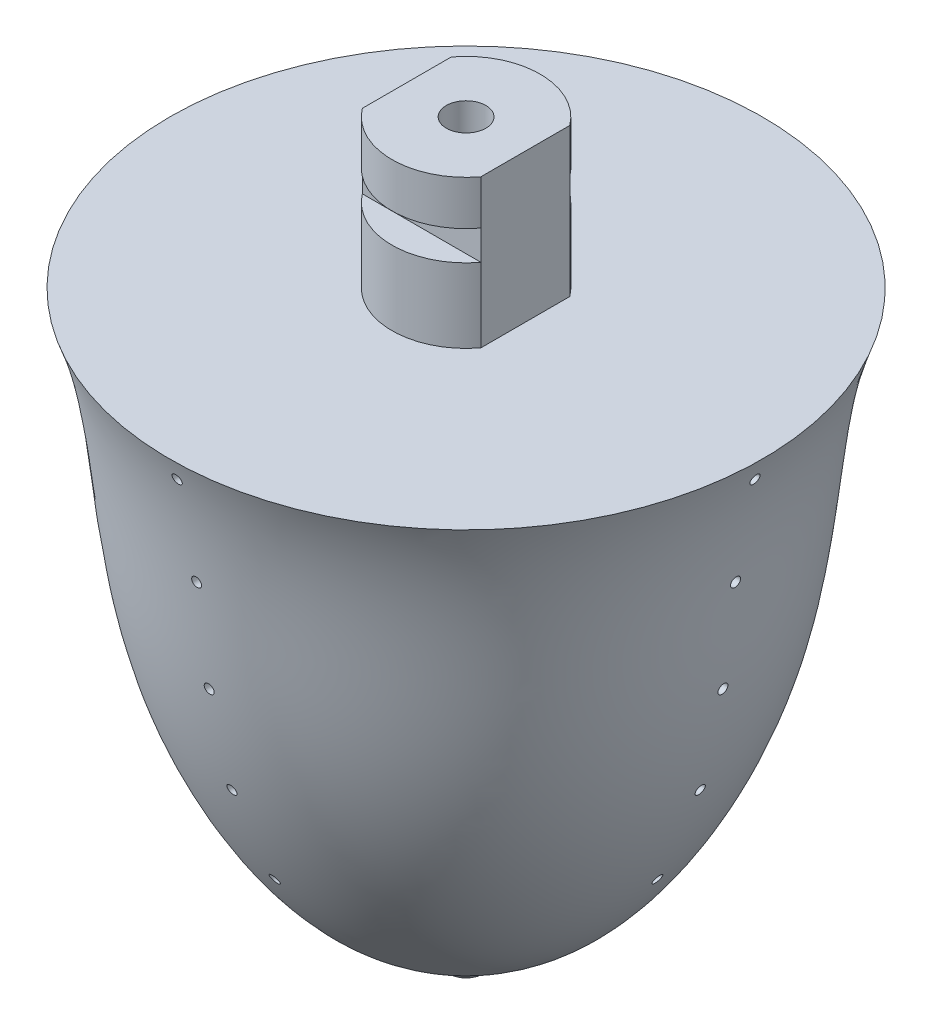
from build123d import *

# Parameters (mm, degrees)
BOSS_EXTRUDE1_DEPTH = 30
SKETCH3_R           = 4
CUT_EXTRUDE1_DEPTH  = 30
CUT_EXTRUDE2_REACH  = 152.867
SKETCH5_W           = 24
SKETCH5_H           = 6
CUT_EXTRUDE3_REACH  = 148.969
SKETCH6_R           = 1
CIRPATTERN1_COUNT   = 4


with BuildPart() as part:
    # Sketch1 → Revolve5 (revolve)
    with BuildSketch(Plane.XY, mode=Mode.PRIVATE) as revolve5_sk:
        with BuildLine():
            Line((0, 0), (60, 0))
            add(Edge.make_bspline(
                [(13.077250629, -110), (26.441462871, -105.381596251), (58.400000122, -57.571050955), (51.598678878, -21.794632863), (60, 0)],
                knots=[0.017667594, 0.017667594, 0.017667594, 0.017667594, 0.353401106, 1, 1, 1, 1], degree=3))
            ThreePointArc((13.077250629, -110), (8.624288133, -112.501880222), (5.3315658, -116.406526078))
            ThreePointArc((5.3315658, -116.406526078), (3.082984988, -118.82225748), (0, -120))
            Line((0, -120), (0, 0))
        make_face()
    revolve(revolve5_sk.sketch.rotate(Axis((0, 0, 0), (0, -1, 0)), 180), axis=Axis((0, 0, 0), (0, -1, 0)))

    # Sketch2 → Boss-Extrude1 (add)
    with BuildSketch(Plane(origin=(0, 0, 0), x_dir=(1, 0, 0), z_dir=(0, 1, 0))):
        with BuildLine():
            Line((12, 9), (12, -9))
            ThreePointArc((12, -9), (0, -15), (-12, -9))
            Line((-12, -9), (-12, 9))
            ThreePointArc((-12, 9), (0, 15), (12, 9))
        make_face()
    extrude(amount=BOSS_EXTRUDE1_DEPTH)

    # Sketch3 → Cut-Extrude1 (cut)
    with BuildSketch(Plane(origin=(0, 30, 0), x_dir=(1, 0, 0), z_dir=(0, 1, 0))):
        with Locations(Location((0, 0, 0), (0, 0, 270))):
            Circle(SKETCH3_R)
    extrude(amount=-CUT_EXTRUDE1_DEPTH, mode=Mode.SUBTRACT)

    # Sketch5 → Cut-Extrude2 (cut, up to next)
    with BuildSketch(Plane.XY.offset(9), mode=Mode.PRIVATE) as cut_extrude2_sk1:
        with Locations((0, 18)):
            Rectangle(SKETCH5_W, SKETCH5_H)
    cut_extrude2_tool1 = extrude(cut_extrude2_sk1.sketch, amount=CUT_EXTRUDE2_REACH, mode=Mode.PRIVATE) & part.part
    cut_extrude2 = cut_extrude2_tool1.solids().sort_by_distance((0, 18, 9))[0]
    add(cut_extrude2, mode=Mode.SUBTRACT)

    # Mirror1: Cut-Extrude2 across plane
    add(cut_extrude2.mirror(Plane.XY), mode=Mode.SUBTRACT)

    # Sketch6 → Cut-Extrude3 (cut, up to next)
    with BuildSketch(Plane(origin=(0, 0, 0), x_dir=(0, 0, -1), z_dir=(1, 0, 0)), mode=Mode.PRIVATE) as cut_extrude3_sk1:
        with Locations((0, -4.298343659)):
            Circle(SKETCH6_R)
    cut_extrude3_tool1 = extrude(cut_extrude3_sk1.sketch, amount=-CUT_EXTRUDE3_REACH, mode=Mode.PRIVATE) & part.part
    # Sketch6 → Cut-Extrude3 (cut, up to next)
    with BuildSketch(Plane(origin=(0, 0, 0), x_dir=(0, 0, -1), z_dir=(1, 0, 0)), mode=Mode.PRIVATE) as cut_extrude3_sk2:
        with Locations((0, -24.298343659)):
            Circle(SKETCH6_R)
    cut_extrude3_tool2 = extrude(cut_extrude3_sk2.sketch, amount=-CUT_EXTRUDE3_REACH, mode=Mode.PRIVATE) & part.part
    # Sketch6 → Cut-Extrude3 (cut, up to next)
    with BuildSketch(Plane(origin=(0, 0, 0), x_dir=(0, 0, -1), z_dir=(1, 0, 0)), mode=Mode.PRIVATE) as cut_extrude3_sk3:
        with Locations((0, -44.298343659)):
            Circle(SKETCH6_R)
    cut_extrude3_tool3 = extrude(cut_extrude3_sk3.sketch, amount=-CUT_EXTRUDE3_REACH, mode=Mode.PRIVATE) & part.part
    # Sketch6 → Cut-Extrude3 (cut, up to next)
    with BuildSketch(Plane(origin=(0, 0, 0), x_dir=(0, 0, -1), z_dir=(1, 0, 0)), mode=Mode.PRIVATE) as cut_extrude3_sk4:
        with Locations((0, -84.298343659)):
            Circle(SKETCH6_R)
    cut_extrude3_tool4 = extrude(cut_extrude3_sk4.sketch, amount=-CUT_EXTRUDE3_REACH, mode=Mode.PRIVATE) & part.part
    # Sketch6 → Cut-Extrude3 (cut, up to next)
    with BuildSketch(Plane(origin=(0, 0, 0), x_dir=(0, 0, -1), z_dir=(1, 0, 0)), mode=Mode.PRIVATE) as cut_extrude3_sk5:
        with Locations((0, -104.298343659)):
            Circle(SKETCH6_R)
    cut_extrude3_tool5 = extrude(cut_extrude3_sk5.sketch, amount=-CUT_EXTRUDE3_REACH, mode=Mode.PRIVATE) & part.part
    # Sketch6 → Cut-Extrude3 (cut, up to next)
    with BuildSketch(Plane(origin=(0, 0, 0), x_dir=(0, 0, -1), z_dir=(1, 0, 0)), mode=Mode.PRIVATE) as cut_extrude3_sk6:
        with Locations((0, -64.298343659)):
            Circle(SKETCH6_R)
    cut_extrude3_tool6 = extrude(cut_extrude3_sk6.sketch, amount=-CUT_EXTRUDE3_REACH, mode=Mode.PRIVATE) & part.part
    cut_extrude3_1 = cut_extrude3_tool1.solids().sort_by_distance((0, -4.298344, 0))[0]
    add(cut_extrude3_1, mode=Mode.SUBTRACT)
    cut_extrude3_2 = cut_extrude3_tool2.solids().sort_by_distance((0, -24.298344, 0))[0]
    add(cut_extrude3_2, mode=Mode.SUBTRACT)
    cut_extrude3_3 = cut_extrude3_tool3.solids().sort_by_distance((0, -44.298344, 0))[0]
    add(cut_extrude3_3, mode=Mode.SUBTRACT)
    cut_extrude3_4 = cut_extrude3_tool4.solids().sort_by_distance((0, -84.298344, 0))[0]
    add(cut_extrude3_4, mode=Mode.SUBTRACT)
    cut_extrude3_5 = cut_extrude3_tool5.solids().sort_by_distance((0, -104.298344, 0))[0]
    add(cut_extrude3_5, mode=Mode.SUBTRACT)
    cut_extrude3_6 = cut_extrude3_tool6.solids().sort_by_distance((0, -64.298344, 0))[0]
    add(cut_extrude3_6, mode=Mode.SUBTRACT)
    cut_extrude3 = cut_extrude3_1 + cut_extrude3_2 + cut_extrude3_3 + cut_extrude3_4 + cut_extrude3_5 + cut_extrude3_6  # Cut-Extrude3 as one shape, for the pattern or mirror that repeats it

    # CirPattern1: Cut-Extrude3 ×4 about axis
    cirpattern1_axis = Axis((0, 0, 0), (0, 1, 0))
    for i in range(1, CIRPATTERN1_COUNT):
        add(cut_extrude3.rotate(cirpattern1_axis, i * 360 / CIRPATTERN1_COUNT), mode=Mode.SUBTRACT)


solid = part.part
